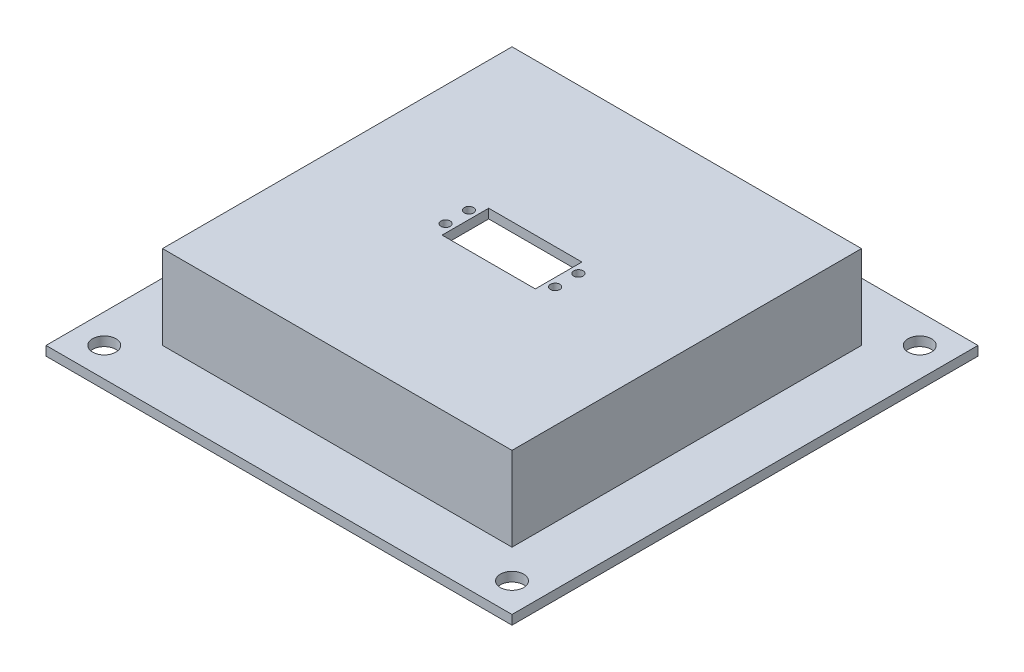
from build123d import *

# Parameters (mm, degrees)
IZIM1_W                     = 150
IZIM1_H                     = 150
Y_KSEKLIK_EKSTR_ZYON1_DEPTH = 40
BO_ALTMA1_T                 = -4
IZIM2_W                     = 200
IZIM2_H                     = 200
IZIM2_W_2                   = 150
IZIM2_H_2                   = 150
Y_KSEKLIK_EKSTR_ZYON2_DEPTH = 4
KES_EKSTR_ZYON1_REACH       = 252.092
IZIM3_R                     = 5
KES_EKSTR_ZYON2_REACH       = 252.699
IZIM4_R                     = 2
IZIM4_W                     = 40
IZIM4_H                     = 20


with BuildPart() as part:
    # Çizim1 → Yükseklik-Ekstrüzyon1 (new body)
    with BuildSketch(Plane(origin=(0, 0, 0), x_dir=(1, 0, 0), z_dir=(0, 1, 0))):
        with Locations((-75, 75)):
            Rectangle(IZIM1_W, IZIM1_H)
    extrude(amount=Y_KSEKLIK_EKSTR_ZYON1_DEPTH)

    # İç Boşaltma1
    bo_altma1_openings = [part.faces().sort_by_distance(p)[0] for p in [
        (-75, 0, -75),
    ]]
    offset(amount=BO_ALTMA1_T, openings=bo_altma1_openings, kind=Kind.INTERSECTION)

    # Çizim2 → Yükseklik-Ekstrüzyon2 (add)
    with BuildSketch(Plane.XZ):
        with Locations((-75, -75)):
            Rectangle(IZIM2_W, IZIM2_H)
        with Locations((-75, -75)):
            Rectangle(IZIM2_W_2, IZIM2_H_2, mode=Mode.SUBTRACT)
    extrude(amount=-Y_KSEKLIK_EKSTR_ZYON2_DEPTH)

    # Çizim3 → Kes-Ekstrüzyon1 (cut, up to next)
    with BuildSketch(Plane(origin=(0, 4, 0), x_dir=(1, 0, 0), z_dir=(0, 1, 0)), mode=Mode.PRIVATE) as kes_ekstr_zyon1_sk1:
        with Locations(Location((12.5, 162.5, 0), (0, 0, 270))):
            Circle(IZIM3_R)
    kes_ekstr_zyon1_tool1 = extrude(kes_ekstr_zyon1_sk1.sketch, amount=-KES_EKSTR_ZYON1_REACH, mode=Mode.PRIVATE) & part.part
    # Çizim3 → Kes-Ekstrüzyon1 (cut, up to next)
    with BuildSketch(Plane(origin=(0, 4, 0), x_dir=(1, 0, 0), z_dir=(0, 1, 0)), mode=Mode.PRIVATE) as kes_ekstr_zyon1_sk2:
        with Locations(Location((12.5, -12.5, 0), (0, 0, 270))):
            Circle(IZIM3_R)
    kes_ekstr_zyon1_tool2 = extrude(kes_ekstr_zyon1_sk2.sketch, amount=-KES_EKSTR_ZYON1_REACH, mode=Mode.PRIVATE) & part.part
    # Çizim3 → Kes-Ekstrüzyon1 (cut, up to next)
    with BuildSketch(Plane(origin=(0, 4, 0), x_dir=(1, 0, 0), z_dir=(0, 1, 0)), mode=Mode.PRIVATE) as kes_ekstr_zyon1_sk3:
        with Locations(Location((-162.5, -12.5, 0), (0, 0, 270))):
            Circle(IZIM3_R)
    kes_ekstr_zyon1_tool3 = extrude(kes_ekstr_zyon1_sk3.sketch, amount=-KES_EKSTR_ZYON1_REACH, mode=Mode.PRIVATE) & part.part
    # Çizim3 → Kes-Ekstrüzyon1 (cut, up to next)
    with BuildSketch(Plane(origin=(0, 4, 0), x_dir=(1, 0, 0), z_dir=(0, 1, 0)), mode=Mode.PRIVATE) as kes_ekstr_zyon1_sk4:
        with Locations(Location((-162.5, 162.5, 0), (0, 0, 270))):
            Circle(IZIM3_R)
    kes_ekstr_zyon1_tool4 = extrude(kes_ekstr_zyon1_sk4.sketch, amount=-KES_EKSTR_ZYON1_REACH, mode=Mode.PRIVATE) & part.part
    add(kes_ekstr_zyon1_tool1.solids().sort_by_distance((12.5, 4, -162.5))[0], mode=Mode.SUBTRACT)
    add(kes_ekstr_zyon1_tool2.solids().sort_by_distance((12.5, 4, 12.5))[0], mode=Mode.SUBTRACT)
    add(kes_ekstr_zyon1_tool3.solids().sort_by_distance((-162.5, 4, 12.5))[0], mode=Mode.SUBTRACT)
    add(kes_ekstr_zyon1_tool4.solids().sort_by_distance((-162.5, 4, -162.5))[0], mode=Mode.SUBTRACT)

    # Çizim4 → Kes-Ekstrüzyon2 (cut, up to next)
    with BuildSketch(Plane(origin=(0, 40, 0), x_dir=(1, 0, 0), z_dir=(0, 1, 0)), mode=Mode.PRIVATE) as kes_ekstr_zyon2_sk1:
        with Locations(Location((-51.5, 70, 0), (0, 0, 270))):
            Circle(IZIM4_R)
    kes_ekstr_zyon2_tool1 = extrude(kes_ekstr_zyon2_sk1.sketch, amount=-KES_EKSTR_ZYON2_REACH, mode=Mode.PRIVATE) & part.part
    # Çizim4 → Kes-Ekstrüzyon2 (cut, up to next)
    with BuildSketch(Plane(origin=(0, 40, 0), x_dir=(1, 0, 0), z_dir=(0, 1, 0)), mode=Mode.PRIVATE) as kes_ekstr_zyon2_sk2:
        with Locations(Location((-51.5, 80, 0), (0, 0, 270))):
            Circle(IZIM4_R)
    kes_ekstr_zyon2_tool2 = extrude(kes_ekstr_zyon2_sk2.sketch, amount=-KES_EKSTR_ZYON2_REACH, mode=Mode.PRIVATE) & part.part
    # Çizim4 → Kes-Ekstrüzyon2 (cut, up to next)
    with BuildSketch(Plane(origin=(0, 40, 0), x_dir=(1, 0, 0), z_dir=(0, 1, 0)), mode=Mode.PRIVATE) as kes_ekstr_zyon2_sk3:
        with Locations(Location((-98.5, 80, 0), (0, 0, 270))):
            Circle(IZIM4_R)
    kes_ekstr_zyon2_tool3 = extrude(kes_ekstr_zyon2_sk3.sketch, amount=-KES_EKSTR_ZYON2_REACH, mode=Mode.PRIVATE) & part.part
    # Çizim4 → Kes-Ekstrüzyon2 (cut, up to next)
    with BuildSketch(Plane(origin=(0, 40, 0), x_dir=(1, 0, 0), z_dir=(0, 1, 0)), mode=Mode.PRIVATE) as kes_ekstr_zyon2_sk4:
        with Locations(Location((-98.5, 70, 0), (0, 0, 270))):
            Circle(IZIM4_R)
    kes_ekstr_zyon2_tool4 = extrude(kes_ekstr_zyon2_sk4.sketch, amount=-KES_EKSTR_ZYON2_REACH, mode=Mode.PRIVATE) & part.part
    # Çizim4 → Kes-Ekstrüzyon2 (cut, up to next)
    with BuildSketch(Plane(origin=(0, 40, 0), x_dir=(1, 0, 0), z_dir=(0, 1, 0)), mode=Mode.PRIVATE) as kes_ekstr_zyon2_sk5:
        with Locations((-75, 75)):
            Rectangle(IZIM4_W, IZIM4_H)
    kes_ekstr_zyon2_tool5 = extrude(kes_ekstr_zyon2_sk5.sketch, amount=-KES_EKSTR_ZYON2_REACH, mode=Mode.PRIVATE) & part.part
    add(kes_ekstr_zyon2_tool1.solids().sort_by_distance((-51.5, 40, -70))[0], mode=Mode.SUBTRACT)
    add(kes_ekstr_zyon2_tool2.solids().sort_by_distance((-51.5, 40, -80))[0], mode=Mode.SUBTRACT)
    add(kes_ekstr_zyon2_tool3.solids().sort_by_distance((-98.5, 40, -80))[0], mode=Mode.SUBTRACT)
    add(kes_ekstr_zyon2_tool4.solids().sort_by_distance((-98.5, 40, -70))[0], mode=Mode.SUBTRACT)
    add(kes_ekstr_zyon2_tool5.solids().sort_by_distance((-75, 40, -75))[0], mode=Mode.SUBTRACT)


solid = part.part
